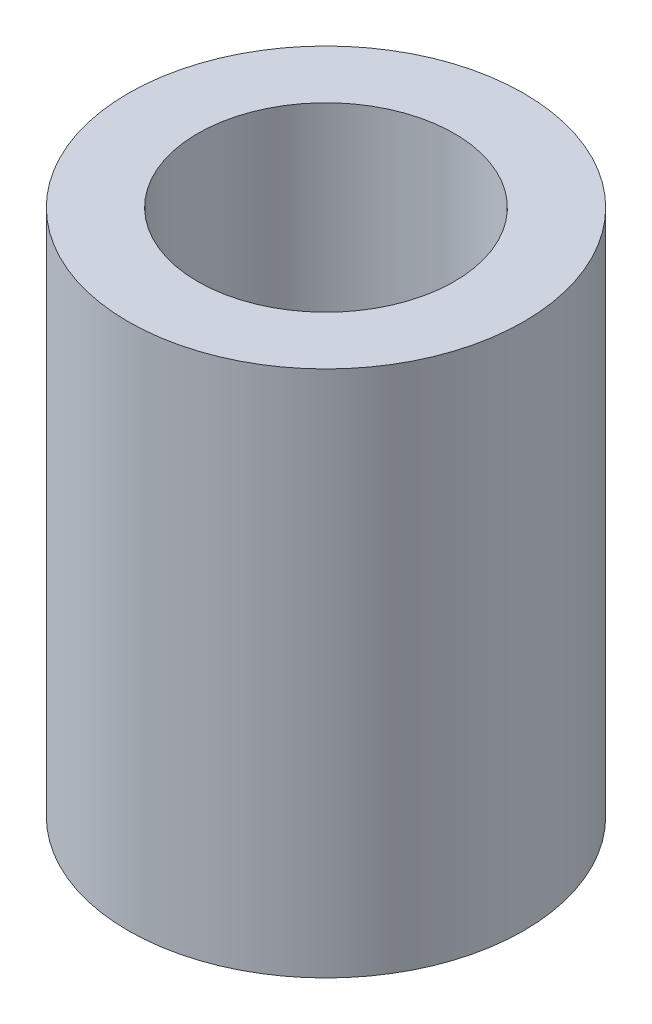
from build123d import *

# Parameters (mm, degrees)
SKETCH1_R           = 7.708333333
SKETCH1_R_2         = 5
BOSS_EXTRUDE3_DEPTH = 10.277777778


with BuildPart() as part:
    # Sketch1 → Boss-Extrude3 (new, symmetric)
    with BuildSketch(Plane(origin=(0, 0, 0), x_dir=(1, 0, 0), z_dir=(0, 1, 0))):
        with Locations(Location((0, 0, 0), (0, 0, 270))):
            Circle(SKETCH1_R)
        with Locations(Location((0, 0, 0), (0, 0, 270))):
            Circle(SKETCH1_R_2, mode=Mode.SUBTRACT)
    extrude(amount=BOSS_EXTRUDE3_DEPTH, both=True)


solid = part.part
